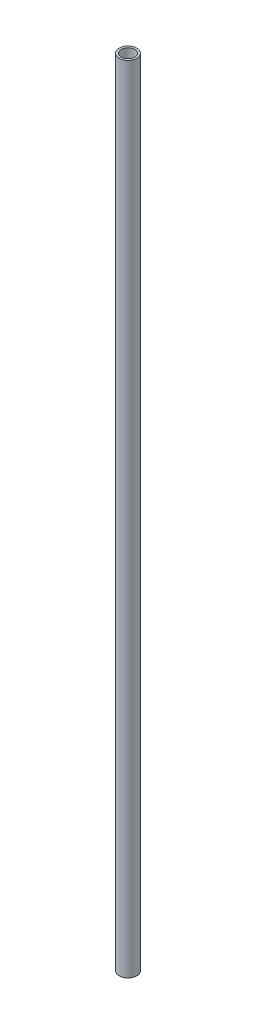
from build123d import *

# Parameters (mm, degrees)
CROQUIS1_R              = 16.7
SALIENTE_EXTRUIR1_DEPTH = 1500
CROQUIS2_R              = 12.7
CORTAR_EXTRUIR1_DEPTH   = 1501.185915145


with BuildPart() as part:
    # Croquis1 → Saliente-Extruir1 (new body)
    with BuildSketch(Plane(origin=(0, 0, 0), x_dir=(1, 0, 0), z_dir=(0, 1, 0))):
        with Locations(Location((0, 0, 0), (0, 0, 270))):
            Circle(CROQUIS1_R)
    extrude(amount=SALIENTE_EXTRUIR1_DEPTH)

    # Croquis2 → Cortar-Extruir1 (cut, through all)
    with BuildSketch(Plane(origin=(0, 1500, 0), x_dir=(1, 0, 0), z_dir=(0, 1, 0))):
        with Locations(Location((0, 0, 0), (0, 0, 270))):
            Circle(CROQUIS2_R)
    extrude(amount=-CORTAR_EXTRUIR1_DEPTH, mode=Mode.SUBTRACT)


solid = part.part
